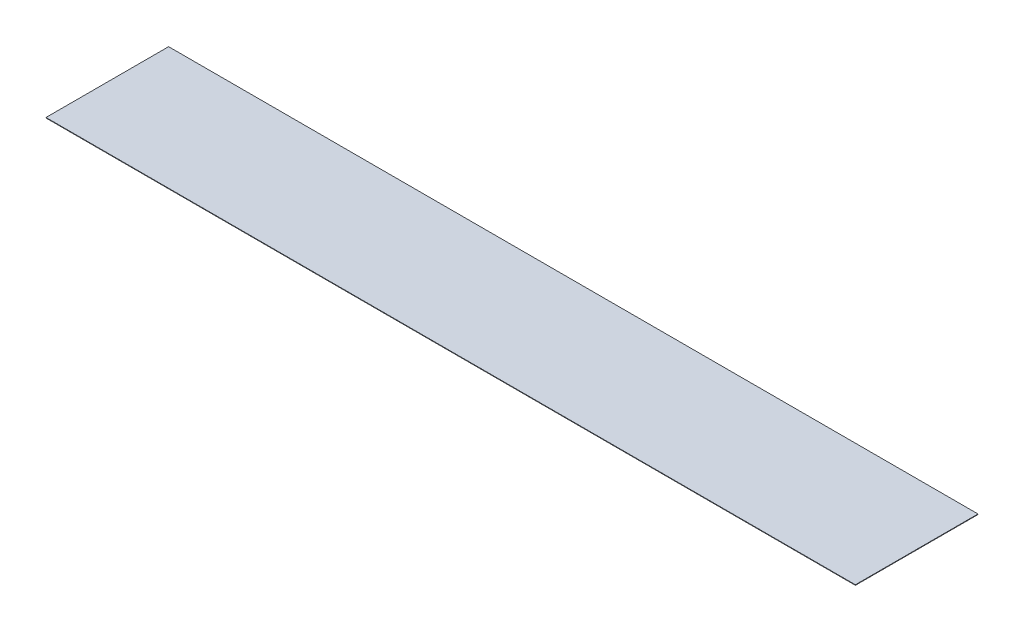
from build123d import *

# Parameters (mm, degrees)
SKETCH1_W           = 15935
SKETCH1_H           = 2414
BOSS_EXTRUDE1_DEPTH = 10


with BuildPart() as part:
    # Sketch1 → Boss-Extrude1 (new body)
    with BuildSketch(Plane(origin=(0, 0, 0), x_dir=(1, 0, 0), z_dir=(0, 1, 0))):
        Rectangle(SKETCH1_W, SKETCH1_H)
    extrude(amount=BOSS_EXTRUDE1_DEPTH)


solid = part.part
